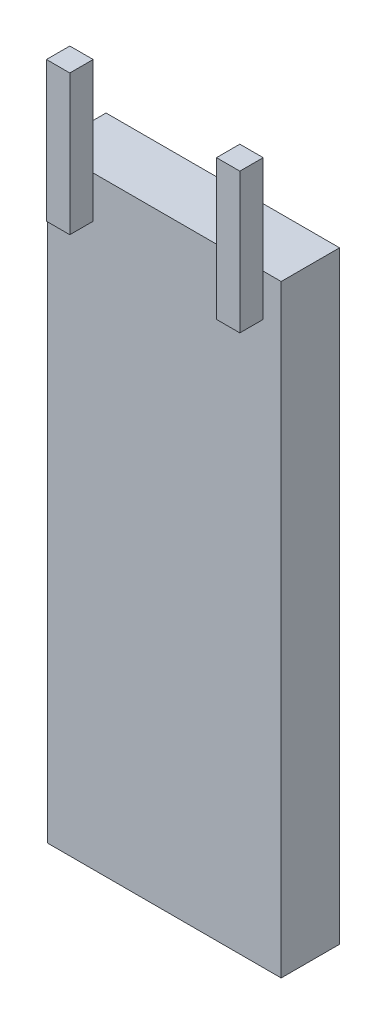
from build123d import *

# Parameters (mm, degrees)
SKICA1_W                 = 1.6
SKICA1_H                 = 0.85
P_IDAT_VYSUNUT_M1_DEPTH  = 0.45
SKICA2_W                 = 6
SKICA2_H                 = 15.5
P_IDAT_VYSUNUT_M2_DEPTH  = 1.5
P_IDAT_START             = 11.5
SKICA4_W                 = 0.6
SKICA4_H                 = 0.6
P_IDAT_VYSUNUT_M4_DEPTH  = 3.6
SKICA6_W                 = 1.6
SKICA6_H                 = 0.85
ODEBRAT_VYSUNUT_M1_DEPTH = 0.45


with BuildPart() as part:
    # Skica1 → Přidat vysunutím1 (new body)
    with BuildSketch(Plane.XY):
        Rectangle(SKICA1_W, SKICA1_H)
    extrude(amount=P_IDAT_VYSUNUT_M1_DEPTH)

    # Skica2 → Přidat vysunutím2 (add)
    with BuildSketch(Plane(origin=(0, 0, 0), x_dir=(-1, 0, 0), z_dir=(0, 0, -1))):
        with Locations((-0.062287775, 4.825)):
            Rectangle(SKICA2_W, SKICA2_H)
    extrude(amount=P_IDAT_VYSUNUT_M2_DEPTH)

    # Skica4 → Přidat vysunutím4 (add)
    with BuildSketch(Plane(origin=(0, 0, 0), x_dir=(1, 0, 0), z_dir=(0, 1, 0)).offset(P_IDAT_START)):
        with Locations((-2.068992039, -0.3)):
            Rectangle(SKICA4_W, SKICA4_H)
        with Locations((2.299906713, -0.3)):
            Rectangle(SKICA4_W, SKICA4_H)
    extrude(amount=P_IDAT_VYSUNUT_M4_DEPTH)

    # Skica6 → Odebrat vysunutím1 (cut)
    with BuildSketch(Plane.XY.offset(0.45)):
        Rectangle(SKICA6_W, SKICA6_H)
    extrude(amount=-ODEBRAT_VYSUNUT_M1_DEPTH, mode=Mode.SUBTRACT)


solid = part.part
